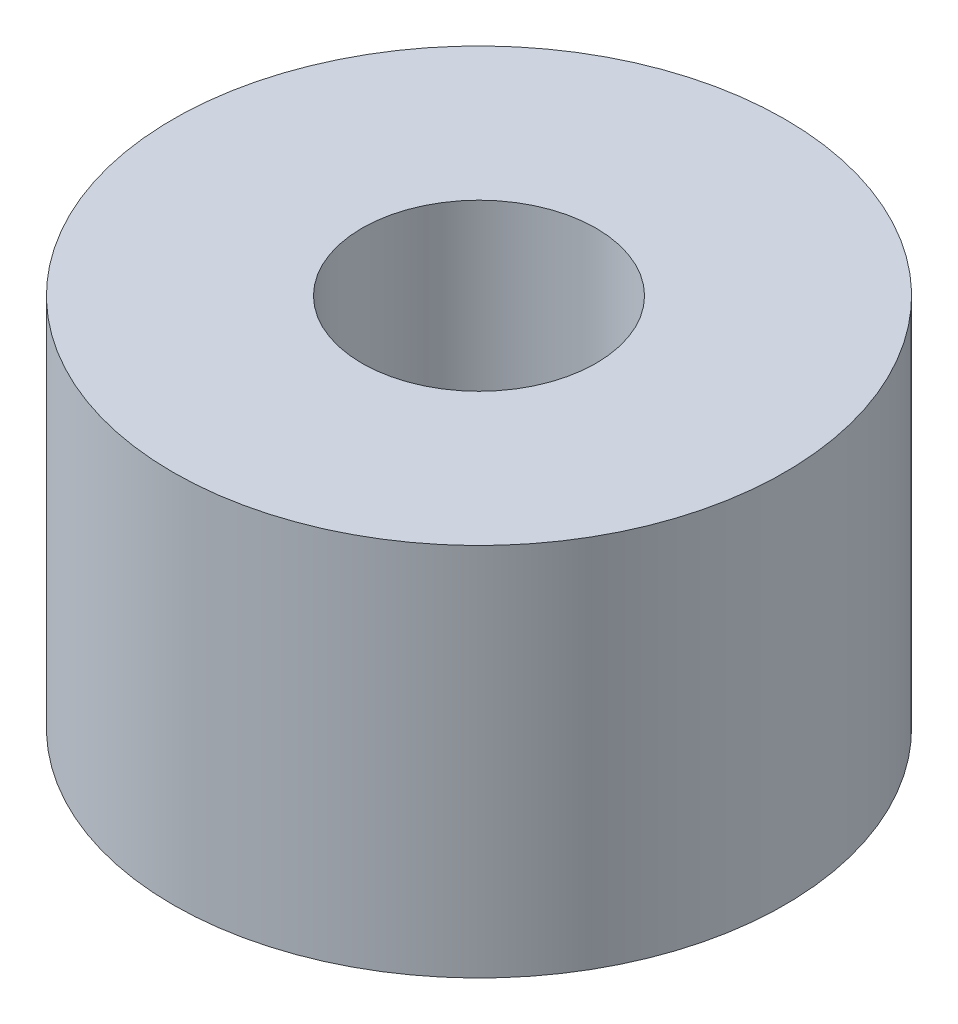
from build123d import *

# Parameters (mm, degrees)
SKETCH1_R           = 12.446
SKETCH1_R_2         = 4.7625
BOSS_EXTRUDE1_DEPTH = 15.24


with BuildPart() as part:
    # Sketch1 → Boss-Extrude1 (new body)
    with BuildSketch(Plane(origin=(0, 0, 0), x_dir=(1, 0, 0), z_dir=(0, 1, 0))):
        with Locations(Location((0, 0, 0), (0, 0, 270))):
            Circle(SKETCH1_R)
        with Locations(Location((0, 0, 0), (0, 0, 270))):
            Circle(SKETCH1_R_2, mode=Mode.SUBTRACT)
    extrude(amount=BOSS_EXTRUDE1_DEPTH)


solid = part.part
